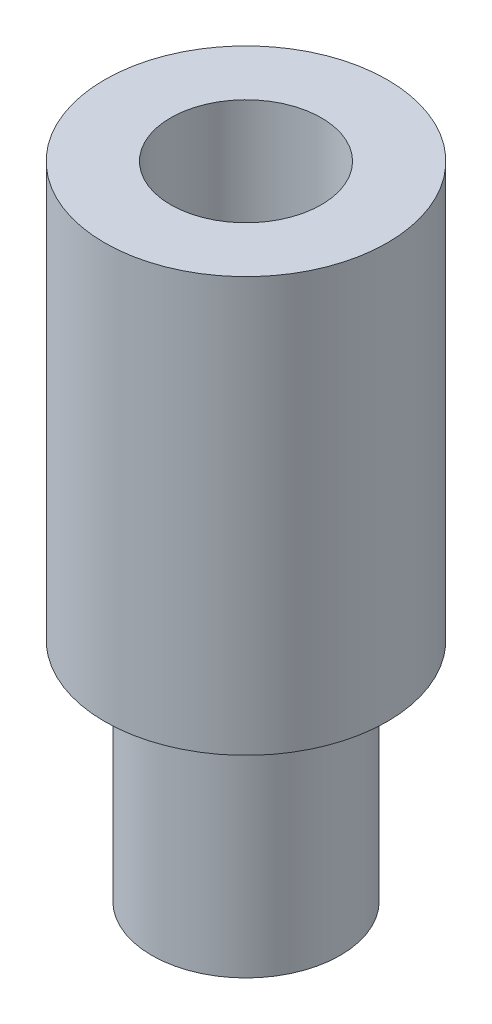
from build123d import *

# Parameters (mm, degrees)
SKETCH1_R           = 5
SKETCH1_R_2         = 1.15
BOSS_EXTRUDE1_DEPTH = 12
SKETCH2_R           = 7.5
SKETCH2_R_2         = 4
BOSS_EXTRUDE2_DEPTH = 22


with BuildPart() as part:
    # Sketch1 → Boss-Extrude1 (new body)
    with BuildSketch(Plane(origin=(0, 0, 0), x_dir=(1, 0, 0), z_dir=(0, 1, 0))):
        with Locations(Location((0, 0, 0), (0, 0, 270))):
            Circle(SKETCH1_R)
        with Locations(Location((0, 0, 0), (0, 0, 270))):
            Circle(SKETCH1_R_2, mode=Mode.SUBTRACT)
    extrude(amount=BOSS_EXTRUDE1_DEPTH)

    # Sketch2 → Boss-Extrude2 (add)
    with BuildSketch(Plane(origin=(0, 12, 0), x_dir=(1, 0, 0), z_dir=(0, 1, 0))):
        with Locations(Location((0, 0, 0), (0, 0, 270))):
            Circle(SKETCH2_R)
        with Locations(Location((0, 0, 0), (0, 0, 270))):
            Circle(SKETCH2_R_2, mode=Mode.SUBTRACT)
    extrude(amount=BOSS_EXTRUDE2_DEPTH)


solid = part.part
